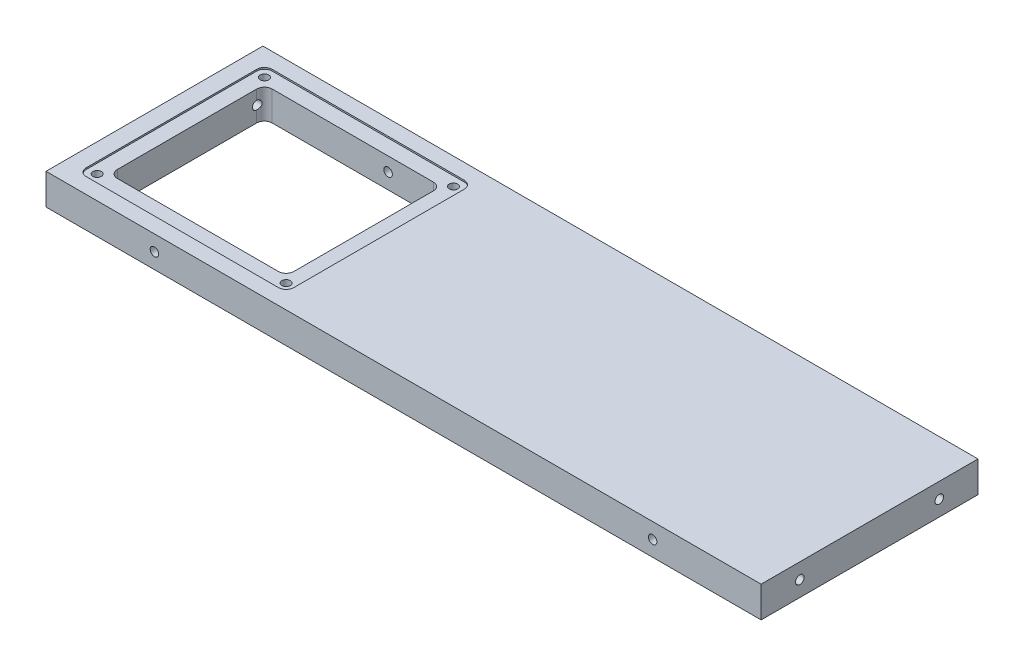
from build123d import *

# Parameters (mm, degrees)
SKETCH1_W           = 461.60558249
SKETCH1_H           = 20
BOSS_EXTRUDE1_DEPTH = 140
SKETCH2_W           = 150
SKETCH2_H           = 12
CUT_EXTRUDE1_DEPTH  = 80
CUT_EXTRUDE2_DEPTH  = 271.684185808
CUT_EXTRUDE3_DEPTH  = 1
SKETCH5_R           = 2.75
CUT_EXTRUDE4_DEPTH  = 12
FILLET1_R           = 5
SKETCH7_R           = 2.75
CUT_EXTRUDE6_DEPTH  = 30
SKETCH8_R           = 2.75
CUT_EXTRUDE7_DEPTH  = 30
BOSS_EXTRUDE2_DEPTH = 12
SKETCH10_R          = 2.75
CUT_EXTRUDE8_DEPTH  = 12
CUT_EXTRUDE5_DEPTH  = 14
SKETCH11_R          = 2.75
CUT_EXTRUDE9_DEPTH  = 30


with BuildPart() as part:
    # Sketch1 → Boss-Extrude1 (new body)
    with BuildSketch(Plane.XY):
        with Locations((0, 417)):
            Rectangle(SKETCH1_W, SKETCH1_H)
    extrude(amount=BOSS_EXTRUDE1_DEPTH)

    # Sketch2 → Cut-Extrude1 (cut)
    with BuildSketch(Plane.XY.offset(140)):
        with Locations((19.197208755, 413)):
            Rectangle(SKETCH2_W, SKETCH2_H)
    extrude(amount=-CUT_EXTRUDE1_DEPTH, mode=Mode.SUBTRACT)

    # Sketch3 → Cut-Extrude2 (cut, through all)
    with BuildSketch(Plane.XZ.offset(-407)):
        with BuildLine():
            Line((-100.802791245, 20), (-204.802791245, 20))
            ThreePointArc((-204.802791245, 20), (-208.338325151, 21.464466094), (-209.802791245, 25))
            Line((-209.802791245, 25), (-209.802791245, 115))
            ThreePointArc((-209.802791245, 115), (-208.338325151, 118.535533906), (-204.802791245, 120))
            Line((-204.802791245, 120), (-100.802791245, 120))
            ThreePointArc((-100.802791245, 120), (-97.267257339, 118.535533906), (-95.802791245, 115))
            Line((-95.802791245, 115), (-95.802791245, 25))
            ThreePointArc((-95.802791245, 25), (-97.267257339, 21.464466094), (-100.802791245, 20))
        make_face()
    extrude(amount=-CUT_EXTRUDE2_DEPTH, mode=Mode.SUBTRACT)

    # Sketch4 → Cut-Extrude3 (cut)
    with BuildSketch(Plane(origin=(0, 427, 0), x_dir=(1, 0, 0), z_dir=(0, 1, 0))):
        with BuildLine():
            Line((-90.802791245, -130), (-214.802791245, -130))
            ThreePointArc((-214.802791245, -130), (-218.338325151, -128.535533906), (-219.802791245, -125))
            Line((-219.802791245, -125), (-219.802791245, -15))
            ThreePointArc((-219.802791245, -15), (-218.338325151, -11.464466094), (-214.802791245, -10))
            Line((-214.802791245, -10), (-90.802791245, -10))
            ThreePointArc((-90.802791245, -10), (-87.267257339, -11.464466094), (-85.802791245, -15))
            Line((-85.802791245, -15), (-85.802791245, -125))
            ThreePointArc((-85.802791245, -125), (-87.267257339, -128.535533906), (-90.802791245, -130))
        make_face()
    extrude(amount=-CUT_EXTRUDE3_DEPTH, mode=Mode.SUBTRACT)

    # Sketch5 → Cut-Extrude4 (cut)
    with BuildSketch(Plane(origin=(0, 426, 0), x_dir=(1, 0, 0), z_dir=(0, 1, 0))):
        with Locations(Location((-91.802791245, -124, 0), (0, 0, 270))):
            Circle(SKETCH5_R)
        with Locations(Location((-213.802791245, -124, 0), (0, 0, 90))):
            Circle(SKETCH5_R)
        with Locations(Location((-213.802791245, -16, 0), (0, 0, 270))):
            Circle(SKETCH5_R)
        with Locations(Location((-91.802791245, -16, 0), (0, 0, 90))):
            Circle(SKETCH5_R)
    extrude(amount=-CUT_EXTRUDE4_DEPTH, mode=Mode.SUBTRACT)

    # Fillet1
    fillet1_edges = [part.edges().sort_by_distance(p)[0] for p in [
        (94.197208755, 413, 60),
        (-55.802791245, 413, 60),
    ]]
    fillet(fillet1_edges, radius=FILLET1_R)

    # Sketch7 → Cut-Extrude6 (cut)
    with BuildSketch(Plane.ZY.offset(230.802791245)):
        with Locations((25, 417)):
            Circle(SKETCH7_R)
        with Locations(Location((115, 417, 0), (0, 0, 270))):
            Circle(SKETCH7_R)
    cut_extrude6 = extrude(amount=-CUT_EXTRUDE6_DEPTH, mode=Mode.SUBTRACT)

    # Mirror1: Cut-Extrude6 across plane
    add(cut_extrude6.mirror(Plane(origin=(0, 0, 0), x_dir=(0, 0, 1), z_dir=(1, 0, 0))), mode=Mode.SUBTRACT)

    # Sketch8 → Cut-Extrude7 (cut)
    with BuildSketch(Plane.XY.offset(140)):
        with Locations((-160.802791245, 417)):
            Circle(SKETCH8_R)
        with Locations(Location((160.802791245, 417, 0), (0, 0, 180))):
            Circle(SKETCH8_R)
    extrude(amount=-CUT_EXTRUDE7_DEPTH, mode=Mode.SUBTRACT)

    # Sketch9 → Boss-Extrude2 (add)
    with BuildSketch(Plane.XZ.offset(-419)):
        with BuildLine():
            Line((94.197208755, 65), (94.197208755, 140))
            Line((94.197208755, 140), (-55.802791245, 140))
            Line((-55.802791245, 140), (-55.802791245, 65))
            ThreePointArc((-55.802791245, 65), (-54.338325151, 61.464466094), (-50.802791245, 60))
            Line((-50.802791245, 60), (89.197208755, 60))
            ThreePointArc((89.197208755, 60), (92.732742661, 61.464466094), (94.197208755, 65))
        make_face()
    extrude(amount=BOSS_EXTRUDE2_DEPTH)

    # Sketch10 → Cut-Extrude8 (cut)
    with BuildSketch(Plane.XZ.offset(-407)):
        with Locations(Location((-85, 126, 0), (0, 0, 270))):
            Circle(SKETCH10_R)
        with Locations(Location((-85, 86, 0), (0, 0, 270))):
            Circle(SKETCH10_R)
        with Locations(Location((60, 126, 0), (0, 0, 270))):
            Circle(SKETCH10_R)
        with Locations(Location((60, 86, 0), (0, 0, 270))):
            Circle(SKETCH10_R)
    extrude(amount=-CUT_EXTRUDE8_DEPTH, mode=Mode.SUBTRACT)

    # Sketch6 → Cut-Extrude5 (cut)
    with BuildSketch(Plane.XZ.offset(-407)):
        with BuildLine():
            Line((200.802791245, 120), (76.802791245, 120))
            ThreePointArc((76.802791245, 120), (73.267257339, 118.535533906), (71.802791245, 115))
            Line((71.802791245, 115), (71.802791245, 25))
            ThreePointArc((71.802791245, 25), (73.267257339, 21.464466094), (76.802791245, 20))
            Line((76.802791245, 20), (200.802791245, 20))
            ThreePointArc((200.802791245, 20), (204.338325151, 21.464466094), (205.802791245, 25))
            Line((205.802791245, 25), (205.802791245, 115))
            ThreePointArc((205.802791245, 115), (204.338325151, 118.535533906), (200.802791245, 120))
        make_face()
        with BuildLine():
            Line((56.802791245, 70), (-80.802791245, 70))
            ThreePointArc((-80.802791245, 70), (-84.338325151, 68.535533906), (-85.802791245, 65))
            Line((-85.802791245, 65), (-85.802791245, 25))
            ThreePointArc((-85.802791245, 25), (-84.338325151, 21.464466094), (-80.802791245, 20))
            Line((-80.802791245, 20), (56.802791245, 20))
            ThreePointArc((56.802791245, 20), (60.338325151, 21.464466094), (61.802791245, 25))
            Line((61.802791245, 25), (61.802791245, 65))
            ThreePointArc((61.802791245, 65), (60.338325151, 68.535533906), (56.802791245, 70))
        make_face()
    extrude(amount=-CUT_EXTRUDE5_DEPTH, mode=Mode.SUBTRACT)

    # Sketch11 → Cut-Extrude9 (cut)
    with BuildSketch(Plane(origin=(0, 0, 0), x_dir=(-1, 0, 0), z_dir=(0, 0, -1))):
        with Locations((130, 417)):
            Circle(SKETCH11_R)
        with Locations((-130, 417)):
            Circle(SKETCH11_R)
    extrude(amount=-CUT_EXTRUDE9_DEPTH, mode=Mode.SUBTRACT)


solid = part.part
